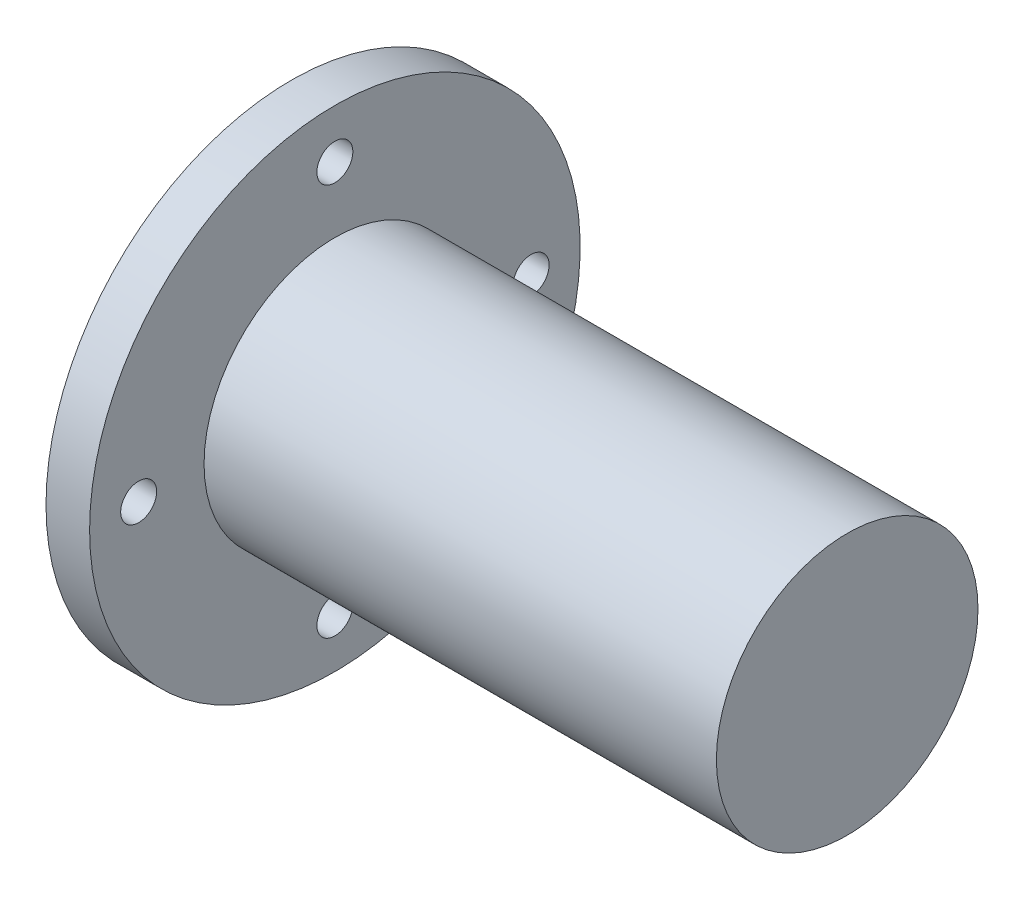
from build123d import *

# Parameters (mm, degrees)
SKETCH_1_W                  = 31
SKETCH_1_H                  = 2
SKETCH_6_R                  = 22.5
SKETCH_6_R_2                = 12
EXTRUDE_1_DEPTH             = 4
SKETCH_8_R                  = 12
SKETCH_8_R_2                = 10
EXTRUDE_3_DEPTH             = 10
SKETCH_9_R                  = 12
EXTRUDE_5_DEPTH             = 10
SKETCH_18_R                 = 10
CUT_EXTRUDE_1_DEPTH         = 46
SKETCH_17_W                 = 1.65
SKETCH_17_H                 = 51
HOLE_WIZARD_M4_1_AT_2_COUNT = 2
HOLE_WIZARD_M4_1_AT_2_PITCH = 25.455844123
HOLE_WIZARD_M4_1_AT_3_COUNT = 2
HOLE_WIZARD_M4_1_AT_3_PITCH = 36
HOLE_WIZARD_M4_1_AT_4_COUNT = 2
HOLE_WIZARD_M4_1_AT_4_PITCH = 25.455844123
SKETCH_12_W                 = 1
SKETCH_12_H                 = 2
CUT_EXTRUDE_START           = -10
SKETCH_19_R                 = 12
SKETCH_19_R_2               = 11
CUT_EXTRUDE_3_DEPTH         = 10
SKETCH_20_W                 = 2.76
SKETCH_20_H                 = 2.86
FILLET_1_R                  = 0.2
CHAMFER_1_SIZE              = 0.3
CHAMFER_2_SIZE              = 0.3
SKETCH_21_R                 = 12
SKETCH_21_R_2               = 11
EXTRUDE_6_DEPTH             = 10


with BuildPart() as part:
    # 草图1 → 旋转1 (revolve)
    with BuildSketch(Plane.XY, mode=Mode.PRIVATE) as revolve_1_sk:
        with Locations((4.5, 11)):
            Rectangle(SKETCH_1_W, SKETCH_1_H)
    revolve(revolve_1_sk.sketch.rotate(Axis((-11, 0, 0), (1, 0, 0)), 90), axis=Axis((-11, 0, 0), (1, 0, 0)))

    # 草图6 → 凸台-拉伸1 (add)
    with BuildSketch(Plane.ZY.offset(11)):
        Circle(SKETCH_6_R)
        Circle(SKETCH_6_R_2, mode=Mode.SUBTRACT)
    extrude(amount=-EXTRUDE_1_DEPTH)

    # 草图8 → 凸台-拉伸3 (add)
    with BuildSketch(Plane(origin=(20, 0, 0), x_dir=(0, 0, -1), z_dir=(1, 0, 0))):
        with Locations(Location((0, 0, 0), (0, 0, 180))):
            Circle(SKETCH_8_R)
        with Locations(Location((0, 0, 0), (0, 0, 180))):
            Circle(SKETCH_8_R_2, mode=Mode.SUBTRACT)
    extrude(amount=EXTRUDE_3_DEPTH)

    # 草图17 → M4 螺纹孔1 (revolve, cut)
    with BuildSketch(Plane(origin=(-11, 18, 0), x_dir=(0, 0, 1), z_dir=(0, 1, 0))):
        with Locations((0.825, 25.5)):
            Rectangle(SKETCH_17_W, SKETCH_17_H)
    hole_wizard_m4_1 = revolve(axis=Axis((-17.35, 18, 0), (1, 0, 0)), mode=Mode.SUBTRACT)

    # M4 螺纹孔1 at 2: M4 螺纹孔1 ×2
    with Locations(*[Vector(0, -0.7071067811865476, 0.7071067811865476) * (i * HOLE_WIZARD_M4_1_AT_2_PITCH) for i in range(1, HOLE_WIZARD_M4_1_AT_2_COUNT)]):
        add(hole_wizard_m4_1, mode=Mode.SUBTRACT)

    # M4 螺纹孔1 at 3: M4 螺纹孔1 ×2
    with Locations(*[(0, -i * HOLE_WIZARD_M4_1_AT_3_PITCH, 0) for i in range(1, HOLE_WIZARD_M4_1_AT_3_COUNT)]):
        add(hole_wizard_m4_1, mode=Mode.SUBTRACT)

    # M4 螺纹孔1 at 4: M4 螺纹孔1 ×2
    with Locations(*[Vector(0, -0.7071067811865477, -0.7071067811865475) * (i * HOLE_WIZARD_M4_1_AT_4_PITCH) for i in range(1, HOLE_WIZARD_M4_1_AT_4_COUNT)]):
        add(hole_wizard_m4_1, mode=Mode.SUBTRACT)

    # 草图20 → 切除-旋转3 (revolve, cut)
    with BuildSketch(Plane(origin=(0, 0, 0), x_dir=(1, 0, 0), z_dir=(0, 1, 0)), mode=Mode.PRIVATE) as cut_revolve_3_sk:
        with Locations((-10.62, 13.7)):
            Rectangle(SKETCH_20_W, SKETCH_20_H)
    revolve(cut_revolve_3_sk.sketch.rotate(Axis((0, 0, 0), (-1, 0, 0)), 180), axis=Axis((0, 0, 0), (-1, 0, 0)), mode=Mode.SUBTRACT)

    # 圆角1
    fillet_1_edges = [part.edges().sort_by_distance(p)[0] for p in [
        (-9.24, 0, -12.27),
        (-9.24, 0, -15.13),
    ]]
    fillet(fillet_1_edges, radius=FILLET_1_R)

    # 倒角1
    chamfer_1_edges = [part.edges().sort_by_distance(p)[0] for p in [
        (-11, 0, -15.13),
    ]]
    chamfer(chamfer_1_edges, length=CHAMFER_1_SIZE)

    # 倒角2
    chamfer_2_edges = [part.edges().sort_by_distance(p)[0] for p in [
        (-11, 0, -12.27),
    ]]
    chamfer(chamfer_2_edges, length=CHAMFER_2_SIZE)



with BuildPart() as body_2:
    # 草图9 → 凸台-拉伸5 (new body)
    with BuildSketch(Plane(origin=(30, 0, 0), x_dir=(0, 0, -1), z_dir=(1, 0, 0))):
        Circle(SKETCH_9_R)
    extrude(amount=EXTRUDE_5_DEPTH)

    # 草图18 → 切除-拉伸1 (cut)
    with BuildSketch(Plane(origin=(-7, 0, 0), x_dir=(0, 0, -1), z_dir=(1, 0, 0))):
        Circle(SKETCH_18_R)
    extrude(amount=CUT_EXTRUDE_1_DEPTH, mode=Mode.SUBTRACT)

    # 草图12 → 切除-旋转2 (revolve, cut)
    with BuildSketch(Plane.XY, mode=Mode.PRIVATE) as cut_revolve_2_sk:
        with Locations((33.5, -12)):
            Rectangle(SKETCH_12_W, SKETCH_12_H)
        with Locations((31.5, -12)):
            Rectangle(SKETCH_12_W, SKETCH_12_H)
        with Locations((35.5, -12)):
            Rectangle(SKETCH_12_W, SKETCH_12_H)
        with Locations((37.5, -12)):
            Rectangle(SKETCH_12_W, SKETCH_12_H)
        with Locations((39.5, -12)):
            Rectangle(SKETCH_12_W, SKETCH_12_H)
    revolve(cut_revolve_2_sk.sketch.rotate(Axis((0, 0, 0), (1, 0, 0)), 270), axis=Axis((0, 0, 0), (1, 0, 0)), mode=Mode.SUBTRACT)

    # 草图19 → 切除-拉伸3 (cut)
    with BuildSketch(Plane(origin=(40, 0, 0), x_dir=(0, 0, -1), z_dir=(1, 0, 0)).offset(CUT_EXTRUDE_START)):
        with Locations(Location((0, 0, 0), (0, 0, 180))):
            Circle(SKETCH_19_R)
        with Locations(Location((0, 0, 0), (0, 0, 180))):
            Circle(SKETCH_19_R_2, mode=Mode.SUBTRACT)
    extrude(amount=CUT_EXTRUDE_3_DEPTH, mode=Mode.SUBTRACT)


with BuildPart() as part_1:
    add(part.part)

    add(body_2.part)  # 凸台-拉伸6 merges body 2
    # 草图21 → 凸台-拉伸6 (add)
    with BuildSketch(Plane(origin=(30, 0, 0), x_dir=(0, 0, -1), z_dir=(1, 0, 0))):
        with Locations(Location((0, 0, 0), (0, 0, 180))):
            Circle(SKETCH_21_R)
        Circle(SKETCH_21_R_2, mode=Mode.SUBTRACT)
    extrude(amount=EXTRUDE_6_DEPTH)


solid = part_1.part
